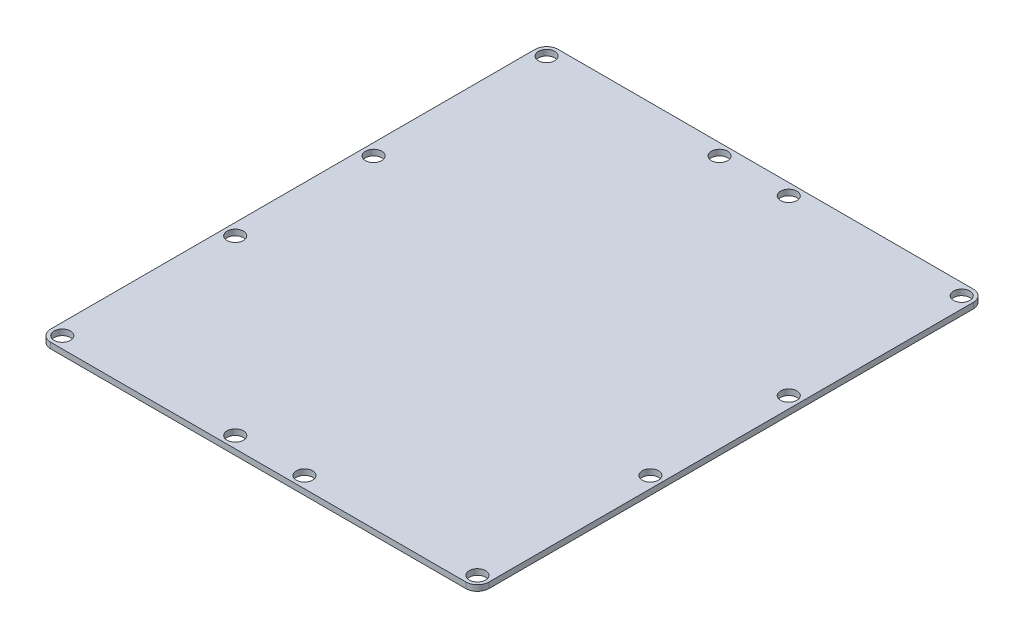
from build123d import *

# Parameters (mm, degrees)
SKETCH1_W             = 120.65
SKETCH1_H             = 139.7
BOSS_EXTRUDE1_DEPTH   = 1.5875
F_8_CLEARANCE_HOLE1_D = 4.4958
FILLET1_R             = 3.175


with BuildPart() as part:
    # Sketch1 → Boss-Extrude1 (new body)
    with BuildSketch(Plane(origin=(0, 0, 0), x_dir=(1, 0, 0), z_dir=(0, 1, 0))):
        Rectangle(SKETCH1_W, SKETCH1_H)
    extrude(amount=BOSS_EXTRUDE1_DEPTH)

    # #8 Clearance Hole1 (through all)
    with Locations(Plane(origin=(0, 1.5875, 0), x_dir=(1, 0, 0), z_dir=(0, 1, 0))):
        with Locations((-57.15, 66.675), (-57.15, 19.05), (-57.15, -19.05), (-57.15, -66.675), (-9.525, -66.675), (9.525, -66.675), (57.15, -66.675), (57.15, -19.05), (57.15, 19.05), (57.15, 66.675), (9.525, 66.675), (-9.525, 66.675)):
            Hole(F_8_CLEARANCE_HOLE1_D / 2)

    # Fillet1
    fillet1_edges = [part.edges().sort_by_distance(p)[0] for p in [
        (-60.325, 0.79375, -69.85),
        (60.325, 0.79375, -69.85),
        (60.325, 0.79375, 69.85),
        (-60.325, 0.79375, 69.85),
    ]]
    fillet(fillet1_edges, radius=FILLET1_R)


solid = part.part
